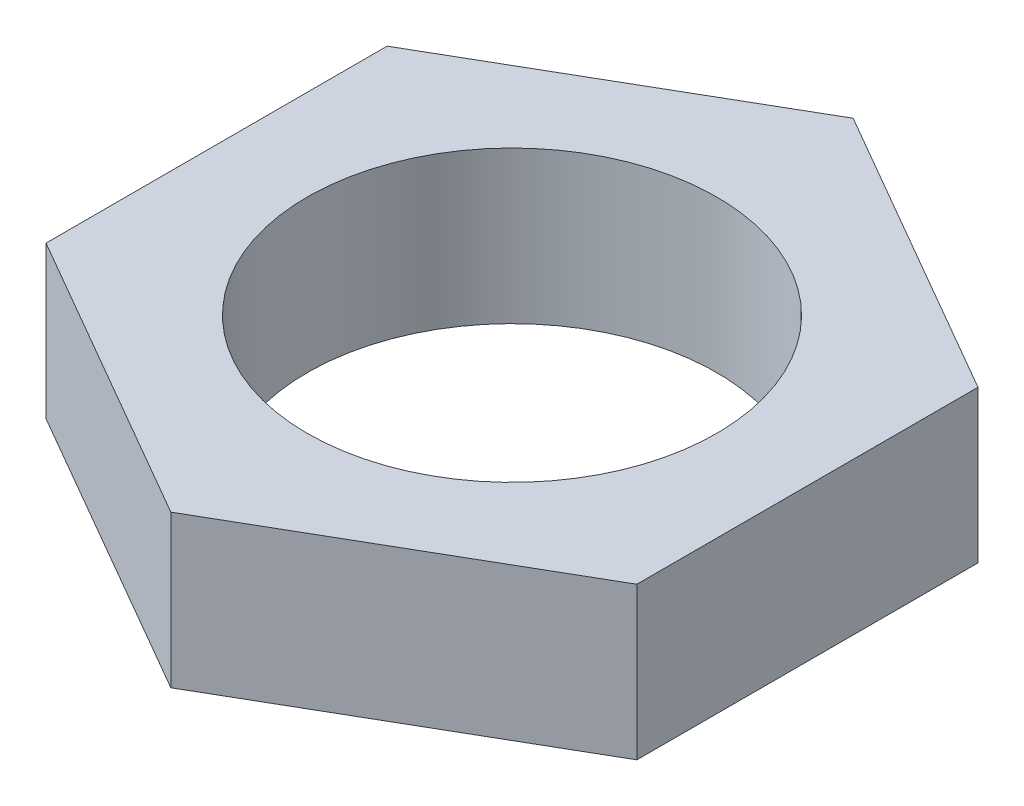
from build123d import *

# Parameters (mm, degrees)
BOSS_EXTRUDE1_DEPTH = 2.6
SKETCH2_R           = 3.5
CUT_EXTRUDE1_DEPTH  = 9.140382874


with BuildPart() as part:
    # Sketch1 → Boss-Extrude1 (new body)
    with BuildSketch(Plane(origin=(0, 0, 0), x_dir=(1, 0, 0), z_dir=(0, 1, 0))):
        Polygon((0, 5.831237719), (-5.05, 2.915618859), (-5.05, -2.915618859), (0, -5.831237719), (5.05, -2.915618859), (5.05, 2.915618859), align=None)
    extrude(amount=BOSS_EXTRUDE1_DEPTH)

    # Sketch2 → Cut-Extrude1 (cut, through all)
    with BuildSketch(Plane(origin=(0, 2.6, 0), x_dir=(1, 0, 0), z_dir=(0, 1, 0))):
        with Locations(Location((0, 0, 0), (0, 0, 270))):
            Circle(SKETCH2_R)
    extrude(amount=-CUT_EXTRUDE1_DEPTH, mode=Mode.SUBTRACT)


solid = part.part
